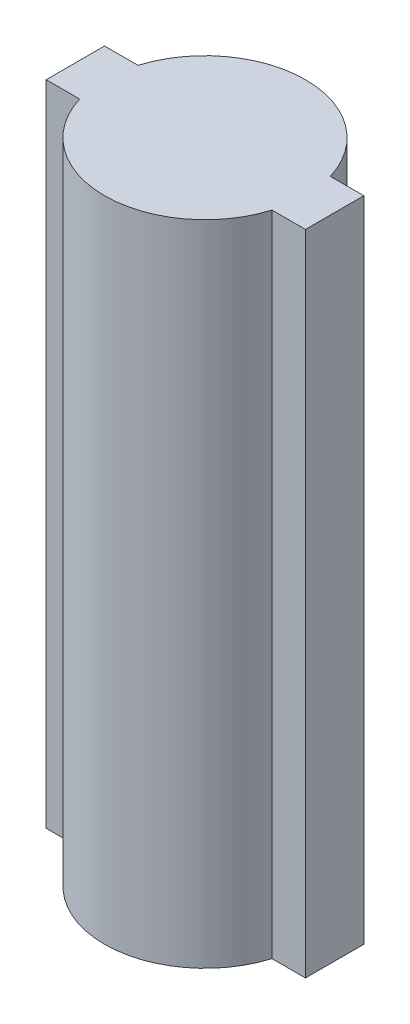
from build123d import *

# Parameters (mm, degrees)
BOSS_EXTRUDE1_DEPTH = 20


with BuildPart() as part:
    # Sketch1 → Boss-Extrude1 (new body)
    with BuildSketch(Plane(origin=(0, 0, 0), x_dir=(1, 0, 0), z_dir=(0, 1, 0))):
        with BuildLine():
            Line((-2.966479395, 0.9), (-4, 0.9))
            Line((-4, 0.9), (-4, -0.9))
            Line((-4, -0.9), (-2.966479395, -0.9))
            ThreePointArc((-2.966479395, -0.9), (-3.1, 0), (-2.966479395, 0.9))
        make_face()
        with BuildLine():
            Line((4, 0.9), (2.966479395, 0.9))
            ThreePointArc((2.966479395, 0.9), (3.066438172, 0.4549252), (3.1, 0))
            ThreePointArc((3.1, 0), (3.066438172, -0.4549252), (2.966479395, -0.9))
            Line((2.966479395, -0.9), (4, -0.9))
            Line((4, -0.9), (4, 0.9))
        make_face()
        with BuildLine():
            Line((2.966479395, 0.9), (-2.966479395, 0.9))
            ThreePointArc((-2.966479395, 0.9), (-3.1, 0), (-2.966479395, -0.9))
            Line((-2.966479395, -0.9), (2.966479395, -0.9))
            ThreePointArc((2.966479395, -0.9), (3.066438172, -0.4549252), (3.1, 0))
            ThreePointArc((3.1, 0), (3.066438172, 0.4549252), (2.966479395, 0.9))
        make_face()
        with BuildLine():
            Line((2.966479395, -0.9), (-2.966479395, -0.9))
            ThreePointArc((-2.966479395, -0.9), (0, -3.1), (2.966479395, -0.9))
        make_face()
        with BuildLine():
            ThreePointArc((2.966479395, 0.9), (0, 3.1), (-2.966479395, 0.9))
            Line((-2.966479395, 0.9), (2.966479395, 0.9))
        make_face()
    extrude(amount=BOSS_EXTRUDE1_DEPTH)


solid = part.part
